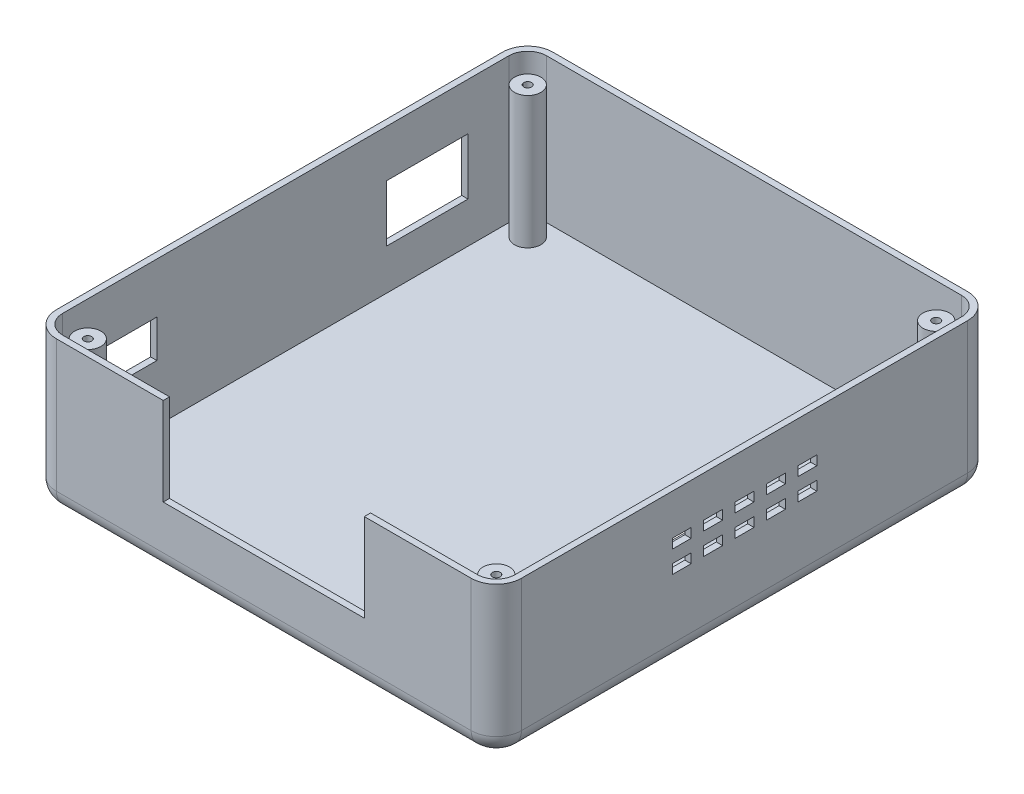
from build123d import *

# Parameters (mm, degrees)
BOSS_EXTRUDE1_DEPTH = 2
BOSS_EXTRUDE2_DEPTH = 46
SKETCH5_R           = 4.2
SKETCH5_R_2         = 1.25
BOSS_EXTRUDE3_DEPTH = 42
FILLET1_R           = 6
SKETCH7_W           = 18
SKETCH7_H           = 12
SKETCH7_W_2         = 26
SKETCH7_H_2         = 18
CUT_EXTRUDE5_DEPTH  = 2
SKETCH9_W           = 6
SKETCH9_H           = 3
CUT_EXTRUDE7_DEPTH  = 2
SKETCH10_W          = 64
SKETCH10_H          = 28
CUT_EXTRUDE8_DEPTH  = 2
SKETCH11_W          = 3
SKETCH11_H          = 34
CUT_EXTRUDE9_DEPTH  = 2


with BuildPart() as part:
    # Sketch3 → Boss-Extrude1 (new body)
    with BuildSketch(Plane(origin=(0, 0, 0), x_dir=(1, 0, 0), z_dir=(0, 1, 0))):
        with BuildLine():
            Line((-66, -79), (66, -79))
            ThreePointArc((66, -79), (71.656854249, -76.656854249), (74, -71))
            Line((74, -71), (74, 71))
            ThreePointArc((74, 71), (71.656854249, 76.656854249), (66, 79))
            Line((66, 79), (-66, 79))
            ThreePointArc((-66, 79), (-71.656854249, 76.656854249), (-74, 71))
            Line((-74, 71), (-74, -71))
            ThreePointArc((-74, -71), (-71.656854249, -76.656854249), (-66, -79))
        make_face()
    extrude(amount=BOSS_EXTRUDE1_DEPTH)

    # Sketch4 → Boss-Extrude2 (add)
    with BuildSketch(Plane(origin=(0, 2, 0), x_dir=(1, 0, 0), z_dir=(0, 1, 0))):
        with BuildLine():
            Line((-66, -79), (66, -79))
            ThreePointArc((66, -79), (71.656854249, -76.656854249), (74, -71))
            Line((74, -71), (74, 71))
            ThreePointArc((74, 71), (71.656854249, 76.656854249), (66, 79))
            Line((66, 79), (-66, 79))
            ThreePointArc((-66, 79), (-71.656854249, 76.656854249), (-74, 71))
            Line((-74, 71), (-74, -71))
            ThreePointArc((-74, -71), (-71.656854249, -76.656854249), (-66, -79))
        make_face()
        with BuildLine():
            Line((-66, -77), (66, -77))
            ThreePointArc((66, -77), (70.242640687, -75.242640687), (72, -71))
            Line((72, -71), (72, 71))
            ThreePointArc((72, 71), (70.242640687, 75.242640687), (66, 77))
            Line((66, 77), (-66, 77))
            ThreePointArc((-66, 77), (-70.242640687, 75.242640687), (-72, 71))
            Line((-72, 71), (-72, -71))
            ThreePointArc((-72, -71), (-70.242640687, -75.242640687), (-66, -77))
        make_face(mode=Mode.SUBTRACT)
    extrude(amount=BOSS_EXTRUDE2_DEPTH)

    # Sketch5 → Boss-Extrude3 (add)
    # profile 1 of 4: a face of its own
    with BuildSketch(Plane(origin=(0, 2, 0), x_dir=(1, 0, 0), z_dir=(0, 1, 0))):
        with Locations((-65, 70)):
            Circle(SKETCH5_R)
        with Locations((-65, 70)):
            Circle(SKETCH5_R_2, mode=Mode.SUBTRACT)
    # profile 2 of 4: a face of its own
    with BuildSketch(Plane(origin=(0, 2, 0), x_dir=(1, 0, 0), z_dir=(0, 1, 0))):
        with Locations((65, 70)):
            Circle(SKETCH5_R)
        with Locations((65, 70)):
            Circle(SKETCH5_R_2, mode=Mode.SUBTRACT)
    # profile 3 of 4: a face of its own
    with BuildSketch(Plane(origin=(0, 2, 0), x_dir=(1, 0, 0), z_dir=(0, 1, 0))):
        with Locations((65, -70)):
            Circle(SKETCH5_R)
        with Locations((65, -70)):
            Circle(SKETCH5_R_2, mode=Mode.SUBTRACT)
    # profile 4 of 4: a face of its own
    with BuildSketch(Plane(origin=(0, 2, 0), x_dir=(1, 0, 0), z_dir=(0, 1, 0))):
        with Locations((-65, -70)):
            Circle(SKETCH5_R)
        with Locations((-65, -70)):
            Circle(SKETCH5_R_2, mode=Mode.SUBTRACT)
    extrude(amount=BOSS_EXTRUDE3_DEPTH)

    # Fillet1
    fillet1_edges = [part.edges().sort_by_distance(p)[0] for p in [
        (-71.656854249, 0, 76.656854249),
        (-71.656854249, 0, -76.656854249),
        (-74, 0, 0),
        (71.656854249, 0, -76.656854249),
        (0, 0, -79),
        (74, 0, 0),
        (71.656854249, 0, 76.656854249),
        (0, 0, 79),
    ]]
    fillet(fillet1_edges, radius=FILLET1_R)

    # Sketch7 → Cut-Extrude5 (cut)
    with BuildSketch(Plane.ZY.offset(74)):
        with Locations((50, 26)):
            Rectangle(SKETCH7_W, SKETCH7_H)
        with Locations((-45, 24)):
            Rectangle(SKETCH7_W_2, SKETCH7_H_2)
    extrude(amount=-CUT_EXTRUDE5_DEPTH, mode=Mode.SUBTRACT)

    # Sketch9 → Cut-Extrude7 (cut)
    with BuildSketch(Plane(origin=(74, 0, 0), x_dir=(0, 0, -1), z_dir=(1, 0, 0))):
        with Locations((0, 33.5)):
            Rectangle(SKETCH9_W, SKETCH9_H)
        with Locations((0, 26.5)):
            Rectangle(SKETCH9_W, SKETCH9_H)
        with Locations((-10, 33.5)):
            Rectangle(SKETCH9_W, SKETCH9_H)
        with Locations((-10, 26.5)):
            Rectangle(SKETCH9_W, SKETCH9_H)
        with Locations((-20, 26.5)):
            Rectangle(SKETCH9_W, SKETCH9_H)
        with Locations((-20, 33.5)):
            Rectangle(SKETCH9_W, SKETCH9_H)
        with Locations((20, 33.5)):
            Rectangle(SKETCH9_W, SKETCH9_H)
        with Locations((20, 26.5)):
            Rectangle(SKETCH9_W, SKETCH9_H)
        with Locations((10, 26.5)):
            Rectangle(SKETCH9_W, SKETCH9_H)
        with Locations((10, 33.5)):
            Rectangle(SKETCH9_W, SKETCH9_H)
    extrude(amount=-CUT_EXTRUDE7_DEPTH, mode=Mode.SUBTRACT)

    # Sketch10 → Cut-Extrude8 (cut)
    with BuildSketch(Plane.XY.offset(79)):
        with Locations((0, 34)):
            Rectangle(SKETCH10_W, SKETCH10_H)
    extrude(amount=-CUT_EXTRUDE8_DEPTH, mode=Mode.SUBTRACT)

    # Sketch11 → Cut-Extrude9 (cut)
    with BuildSketch(Plane.XZ):
        with Locations((58, 0)):
            Rectangle(SKETCH11_W, SKETCH11_H)
        with Locations((46, 0)):
            Rectangle(SKETCH11_W, SKETCH11_H)
        with Locations((52, 0)):
            Rectangle(SKETCH11_W, SKETCH11_H)
        with Locations((40, 0)):
            Rectangle(SKETCH11_W, SKETCH11_H)
        with Locations((34, 0)):
            Rectangle(SKETCH11_W, SKETCH11_H)
        with Locations((28, 0)):
            Rectangle(SKETCH11_W, SKETCH11_H)
    extrude(amount=-CUT_EXTRUDE9_DEPTH, mode=Mode.SUBTRACT)


solid = part.part
